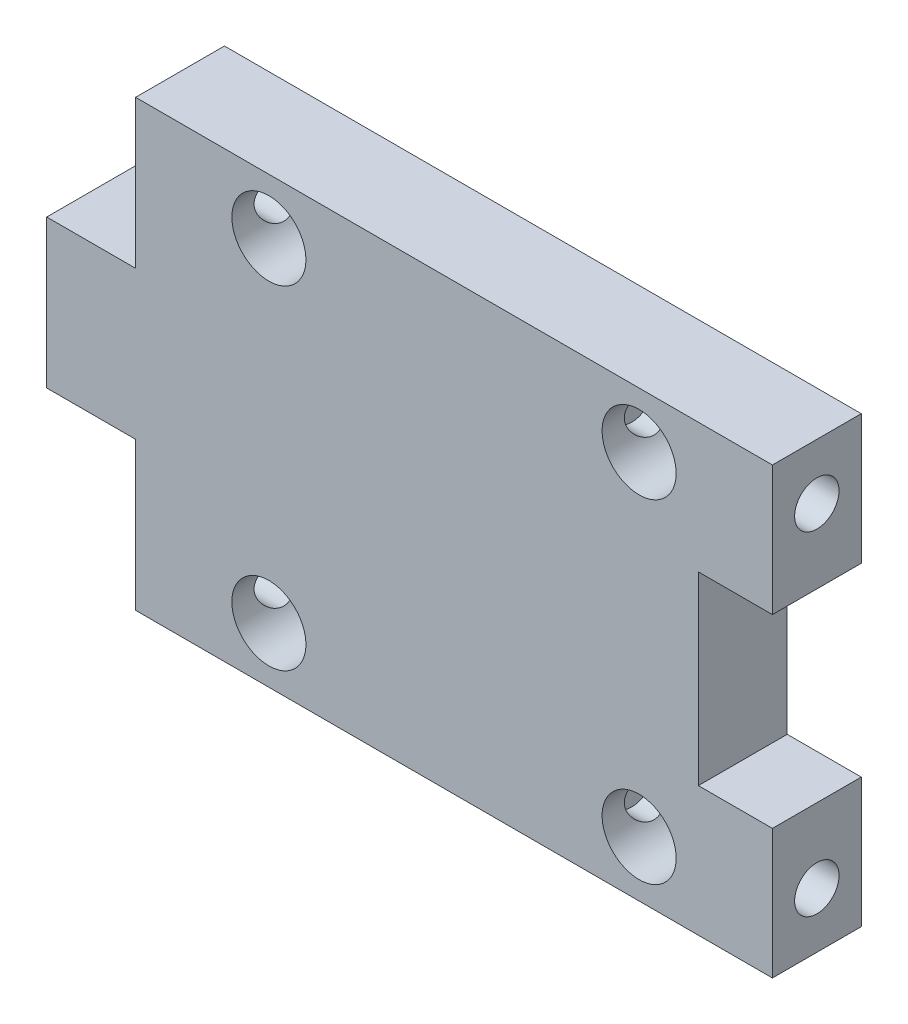
from build123d import *

# Parameters (mm, degrees)
SKETCH1_W           = 86
SKETCH1_H           = 60
BOSS_EXTRUDE1_DEPTH = 12
CUT_EXTRUDE1_REACH  = 107.546
SKETCH2_W           = 20
SKETCH2_H           = 25
SKETCH3_W           = 24
SKETCH3_H           = 20
BOSS_EXTRUDE2_DEPTH = 12
CUT_EXTRUDE2_REACH  = 107.546
SKETCH4_R           = 5
SKETCH5_R           = 3
CUT_EXTRUDE3_DEPTH  = 25


with BuildPart() as part:
    # Sketch1 → Boss-Extrude1 (new body)
    with BuildSketch(Plane.XY):
        with Locations((43, 30)):
            Rectangle(SKETCH1_W, SKETCH1_H)
    extrude(amount=BOSS_EXTRUDE1_DEPTH)

    # Sketch2 → Cut-Extrude1 (cut, up to next)
    with BuildSketch(Plane.XY.offset(12), mode=Mode.PRIVATE) as cut_extrude1_sk1:
        with Locations((86, 30)):
            Rectangle(SKETCH2_W, SKETCH2_H)
    cut_extrude1_tool1 = extrude(cut_extrude1_sk1.sketch, amount=-CUT_EXTRUDE1_REACH, mode=Mode.PRIVATE) & part.part
    add(cut_extrude1_tool1.solids().sort_by_distance((86, 30, 12))[0], mode=Mode.SUBTRACT)

    # Sketch3 → Boss-Extrude2 (add)
    with BuildSketch(Plane.XY.offset(12)):
        with Locations((0, 30)):
            Rectangle(SKETCH3_W, SKETCH3_H)
    extrude(amount=-BOSS_EXTRUDE2_DEPTH)

    # Sketch4 → Cut-Extrude2 (cut, up to next)
    with BuildSketch(Plane.XY.offset(12), mode=Mode.PRIVATE) as cut_extrude2_sk1:
        with Locations((68, 52.5)):
            Circle(SKETCH4_R)
    cut_extrude2_tool1 = extrude(cut_extrude2_sk1.sketch, amount=-CUT_EXTRUDE2_REACH, mode=Mode.PRIVATE) & part.part
    # Sketch4 → Cut-Extrude2 (cut, up to next)
    with BuildSketch(Plane.XY.offset(12), mode=Mode.PRIVATE) as cut_extrude2_sk2:
        with Locations((68, 7.5)):
            Circle(SKETCH4_R)
    cut_extrude2_tool2 = extrude(cut_extrude2_sk2.sketch, amount=-CUT_EXTRUDE2_REACH, mode=Mode.PRIVATE) & part.part
    cut_extrude2_1 = cut_extrude2_tool1.solids().sort_by_distance((68, 52.5, 12))[0]
    add(cut_extrude2_1, mode=Mode.SUBTRACT)
    cut_extrude2_2 = cut_extrude2_tool2.solids().sort_by_distance((68, 7.5, 12))[0]
    add(cut_extrude2_2, mode=Mode.SUBTRACT)
    cut_extrude2 = cut_extrude2_1 + cut_extrude2_2  # Cut-Extrude2 as one shape, for the pattern or mirror that repeats it

    # Sketch5 → Cut-Extrude3 (cut)
    with BuildSketch(Plane(origin=(86, 0, 0), x_dir=(0, 0, -1), z_dir=(1, 0, 0))):
        with Locations((-6, 52.5)):
            Circle(SKETCH5_R)
        with Locations((-6, 7.5)):
            Circle(SKETCH5_R)
    cut_extrude3 = extrude(amount=-CUT_EXTRUDE3_DEPTH, mode=Mode.SUBTRACT)

    # Mirror2: Cut-Extrude2, Cut-Extrude3 across plane
    add(cut_extrude2.mirror(Plane.ZY.offset(-43)), mode=Mode.SUBTRACT)
    add(cut_extrude3.mirror(Plane.ZY.offset(-43)), mode=Mode.SUBTRACT)


solid = part.part
